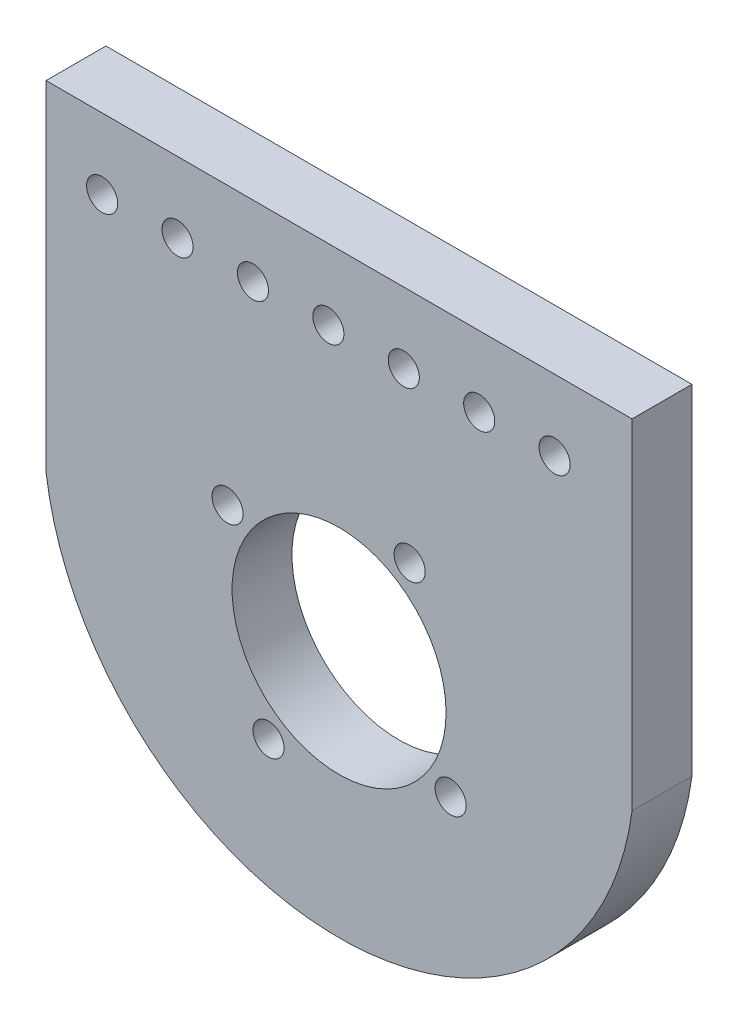
from build123d import *

# Parameters (mm, degrees)
SKETCH1_R           = 11.35
SKETCH1_R_2         = 1.65
BOSS_EXTRUDE1_DEPTH = 6.35


with BuildPart() as part:
    # Sketch1 → Boss-Extrude1 (new body)
    with BuildSketch(Plane.XY):
        with BuildLine():
            Line((-31.082201122, 36.863873201), (31.082201122, 36.863873201))
            Line((31.082201122, 36.863873201), (31.082201122, 0.863873201))
            ThreePointArc((31.082201122, 0.863873201), (0, -26.356191916), (-31.082201122, 0.863873201))
            Line((-31.082201122, 0.863873201), (-31.082201122, 36.863873201))
        make_face()
        Circle(SKETCH1_R, mode=Mode.SUBTRACT)
        with Locations((-11.832036089, 7.483510005)):
            Circle(SKETCH1_R_2, mode=Mode.SUBTRACT)
        with Locations((7.483510005, 11.832036089)):
            Circle(SKETCH1_R_2, mode=Mode.SUBTRACT)
        with Locations((11.832036089, -7.483510005)):
            Circle(SKETCH1_R_2, mode=Mode.SUBTRACT)
        with Locations((-7.483510005, -11.832036089)):
            Circle(SKETCH1_R_2, mode=Mode.SUBTRACT)
        with Locations((-25.135580542, 29.363873201)):
            Circle(SKETCH1_R_2, mode=Mode.SUBTRACT)
        with Locations((-17.135580542, 29.363873201)):
            Circle(SKETCH1_R_2, mode=Mode.SUBTRACT)
        with Locations((-9.135580542, 29.363873201)):
            Circle(SKETCH1_R_2, mode=Mode.SUBTRACT)
        with Locations((-1.135580542, 29.363873201)):
            Circle(SKETCH1_R_2, mode=Mode.SUBTRACT)
        with Locations((6.864419458, 29.363873201)):
            Circle(SKETCH1_R_2, mode=Mode.SUBTRACT)
        with Locations((14.864419458, 29.363873201)):
            Circle(SKETCH1_R_2, mode=Mode.SUBTRACT)
        with Locations((22.864419458, 29.363873201)):
            Circle(SKETCH1_R_2, mode=Mode.SUBTRACT)
    extrude(amount=BOSS_EXTRUDE1_DEPTH)


solid = part.part
